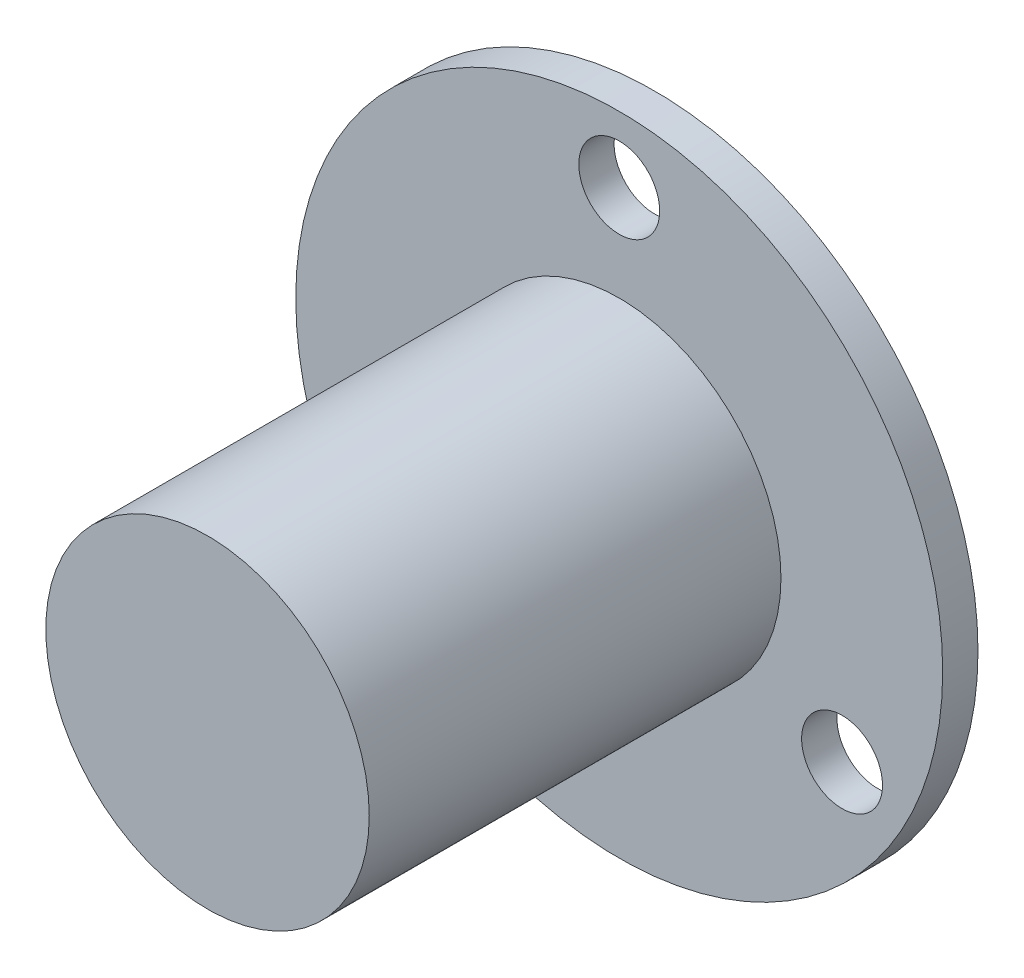
from build123d import *

# Parameters (mm, degrees)
SKETCH1_R           = 22
SKETCH1_R_2         = 2.75
BOSS_EXTRUDE1_DEPTH = 2.4
SKETCH2_R           = 11
BOSS_EXTRUDE2_DEPTH = 28
SKETCH3_R           = 3.9
BOSS_EXTRUDE3_DEPTH = 9


with BuildPart() as part:
    # Sketch1 → Boss-Extrude1 (new body)
    with BuildSketch(Plane.XY):
        Circle(SKETCH1_R)
        with Locations((0, 17.5)):
            Circle(SKETCH1_R_2, mode=Mode.SUBTRACT)
        with Locations((15.155444566, -8.75)):
            Circle(SKETCH1_R_2, mode=Mode.SUBTRACT)
        with Locations((-15.155444566, -8.75)):
            Circle(SKETCH1_R_2, mode=Mode.SUBTRACT)
    extrude(amount=BOSS_EXTRUDE1_DEPTH)

    # Sketch2 → Boss-Extrude2 (add)
    with BuildSketch(Plane.XY.offset(2.4)):
        Circle(SKETCH2_R)
    extrude(amount=BOSS_EXTRUDE2_DEPTH)

    # Sketch3 → Boss-Extrude3 (add)
    with BuildSketch(Plane(origin=(0, 0, 0), x_dir=(-1, 0, 0), z_dir=(0, 0, -1))):
        with Locations(Location((0, 0, 0), (0, 0, 180))):
            Circle(SKETCH3_R)
    extrude(amount=BOSS_EXTRUDE3_DEPTH)


solid = part.part
